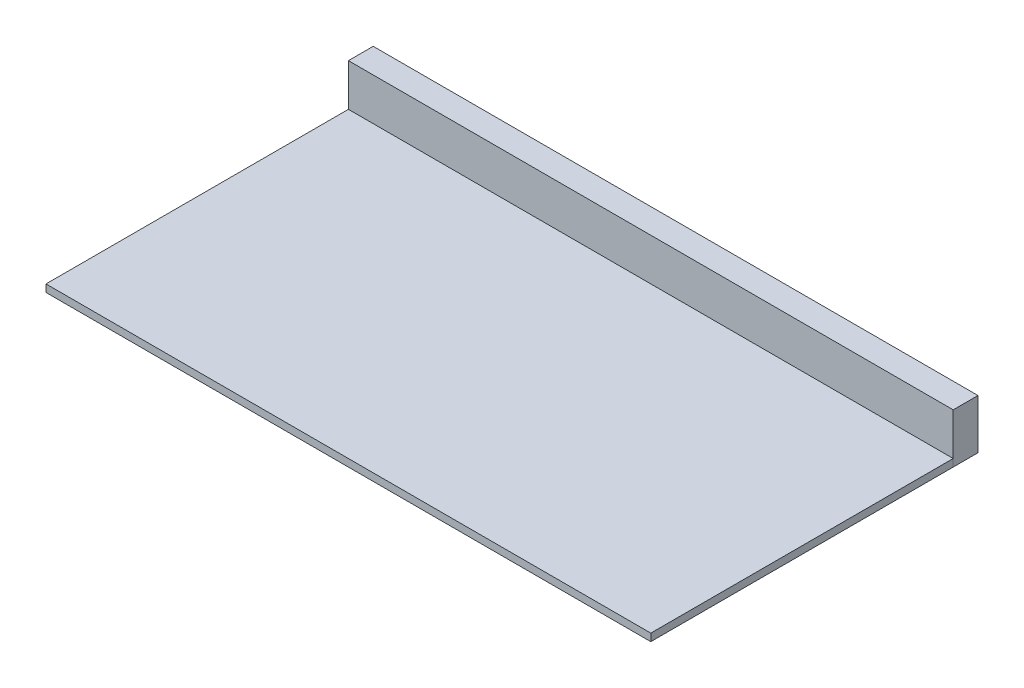
from build123d import *

# Parameters (mm, degrees)
SKETCH1_W           = 2438.4
SKETCH1_H           = 1219.2
BOSS_EXTRUDE1_DEPTH = 30
SKETCH2_W           = 2438.4
SKETCH2_H           = 100
BOSS_EXTRUDE2_DEPTH = 200


with BuildPart() as part:
    # Sketch1 → Boss-Extrude1 (new body)
    with BuildSketch(Plane(origin=(0, 0, 0), x_dir=(1, 0, 0), z_dir=(0, 1, 0))):
        with Locations((1219.2, 609.6)):
            Rectangle(SKETCH1_W, SKETCH1_H)
    extrude(amount=BOSS_EXTRUDE1_DEPTH)


with BuildPart() as body_2:
    # Sketch2 → Boss-Extrude2 (new body)
    with BuildSketch(Plane.XZ):
        with Locations((1219.2, -1269.2)):
            Rectangle(SKETCH2_W, SKETCH2_H)
    extrude(amount=-BOSS_EXTRUDE2_DEPTH)


solid = Compound([part.part, body_2.part])
